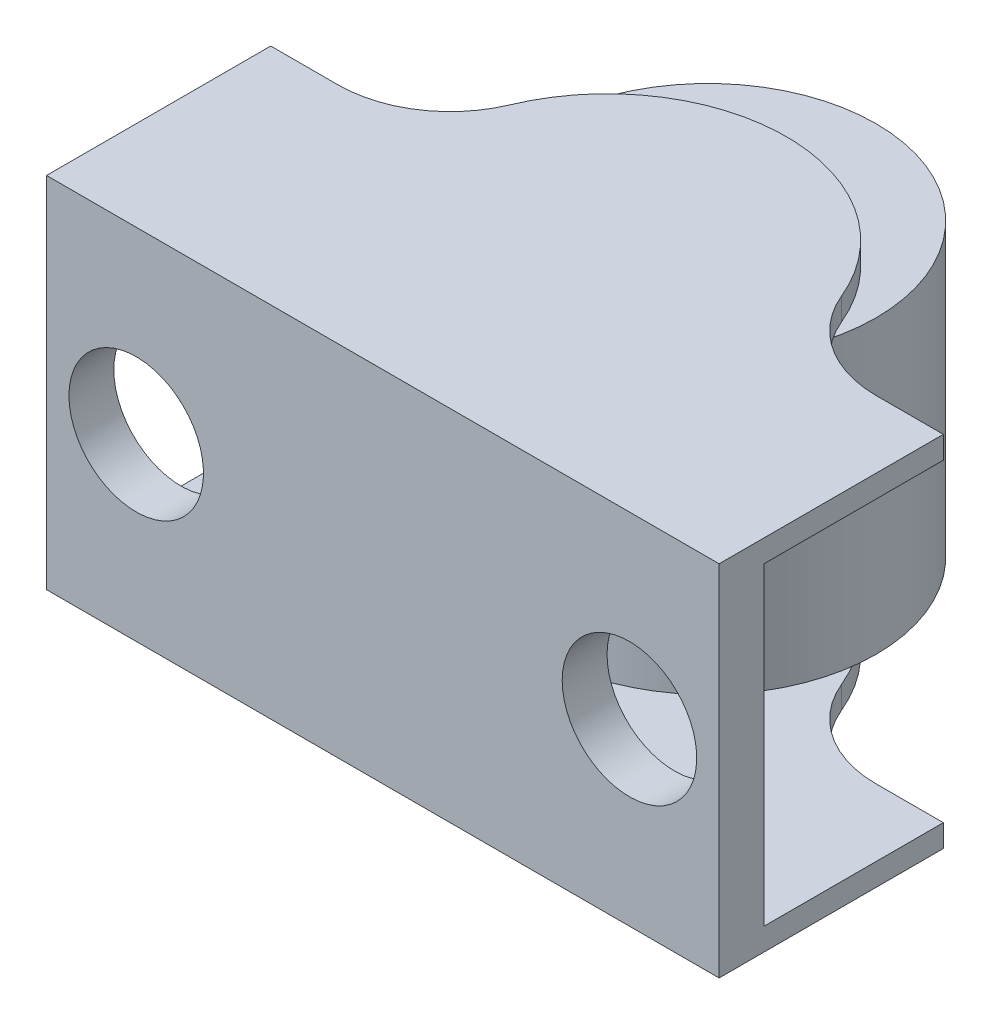
from build123d import *

# Parameters (mm, degrees)
SKETCH_1_W          = 30
SKETCH_1_H          = 16
EXTRUDE_1_DEPTH     = 2
EXTRUDE_2_DEPTH     = 1
SKETCH_3_R          = 2.5
EXTRUDE_3_DEPTH     = 15
SKETCH_4_W          = 7.5
SKETCH_4_H          = 13
SKETCH_5_R          = 3
CUT_EXTRUDE_1_DEPTH = 27.248809497


with BuildPart() as part:
    # 草圖1 → 填料-伸長1 (new body)
    with BuildSketch(Plane.XY):
        Rectangle(SKETCH_1_W, SKETCH_1_H)
    extrude(amount=EXTRUDE_1_DEPTH)

    # 草圖2 → 填料-伸長2 (add)
    with BuildSketch(Plane(origin=(0, 8, 0), x_dir=(1, 0, 0), z_dir=(0, 1, 0))):
        with BuildLine():
            Line((-15, 0), (15, 0))
            Line((15, 0), (15, 8))
            Line((15, 8), (12, 8))
            ThreePointArc((12, 8), (9.226499019, 8.839748528), (7.384615385, 11.076923077))
            ThreePointArc((7.384615385, 11.076923077), (0, 16), (-7.384615385, 11.076923077))
            ThreePointArc((-7.384615385, 11.076923077), (-9.226499019, 8.839748528), (-12, 8))
            Line((-12, 8), (-15, 8))
            Line((-15, 8), (-15, 0))
        make_face()
    extrude_2 = extrude(amount=-EXTRUDE_2_DEPTH)

    # 鏡射1: 填料-伸長2 across plane
    add(extrude_2.mirror(Plane.ZX))

    # 草圖3 → 填料-伸長3 (add)
    with BuildSketch(Plane(origin=(0, 8, 0), x_dir=(1, 0, 0), z_dir=(0, 1, 0))):
        with Locations(Location((0, 12, 0), (0, 0, 270))):
            Circle(SKETCH_3_R)
    extrude(amount=-EXTRUDE_3_DEPTH)

    # 草圖4 → 旋轉1 (revolve)
    with BuildSketch(Plane(origin=(0, 0, -12.5), x_dir=(-1, 0, 0), z_dir=(0, 0, -1))):
        with Locations((3.75, 0)):
            Rectangle(SKETCH_4_W, SKETCH_4_H)
    revolve(axis=Axis((0, 6.5, -12.5), (0, -1, 0)))

    # 草圖5 → 除料-伸長1 (cut, through all)
    with BuildSketch(Plane(origin=(0, 0, 0), x_dir=(-1, 0, 0), z_dir=(0, 0, -1))):
        with Locations((-11, 0)):
            Circle(SKETCH_5_R)
        with Locations((11, 0)):
            Circle(SKETCH_5_R)
    extrude(amount=-CUT_EXTRUDE_1_DEPTH, mode=Mode.SUBTRACT)


solid = part.part
